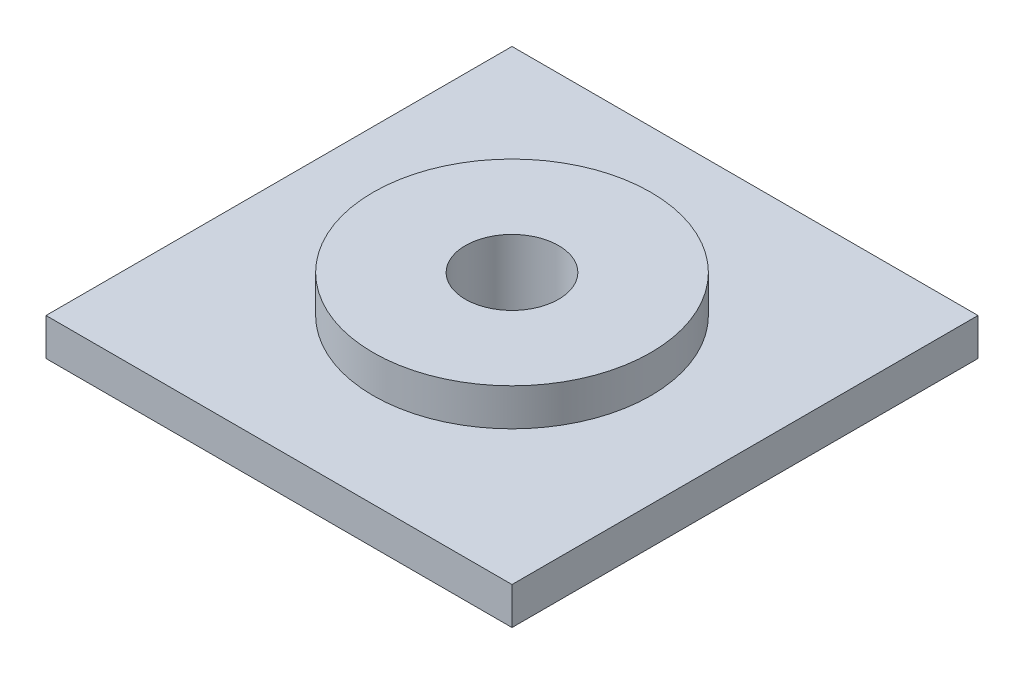
from build123d import *

# Parameters (mm, degrees)
SKETCH1_W           = 25
SKETCH1_H           = 25
BOSS_EXTRUDE1_DEPTH = 2
SKETCH2_R           = 7.45
BOSS_EXTRUDE2_DEPTH = 2
SKETCH3_R           = 2.5
CUT_EXTRUDE1_DEPTH  = 19.12456896
CUT_EXTRUDE2_DEPTH  = 1


with BuildPart() as part:
    # Sketch1 → Boss-Extrude1 (new body)
    with BuildSketch(Plane(origin=(0, 0, 0), x_dir=(1, 0, 0), z_dir=(0, 1, 0))):
        Rectangle(SKETCH1_W, SKETCH1_H)
    extrude(amount=BOSS_EXTRUDE1_DEPTH)

    # Sketch2 → Boss-Extrude2 (add)
    with BuildSketch(Plane(origin=(0, 2, 0), x_dir=(1, 0, 0), z_dir=(0, 1, 0))):
        with Locations(Location((0, 0, 0), (0, 0, 90))):
            Circle(SKETCH2_R)
    extrude(amount=BOSS_EXTRUDE2_DEPTH)

    # Sketch3 → Cut-Extrude1 (cut, through all)
    with BuildSketch(Plane(origin=(0, 4, 0), x_dir=(1, 0, 0), z_dir=(0, 1, 0))):
        with Locations(Location((0, 0, 0), (0, 0, 270))):
            Circle(SKETCH3_R)
    extrude(amount=-CUT_EXTRUDE1_DEPTH, mode=Mode.SUBTRACT)

    # Sketch4 → Cut-Extrude2 (cut)
    with BuildSketch(Plane(origin=(0, 0, 0), x_dir=(1, 0, 0), z_dir=(0, 1, 0))):
        with BuildLine():
            Line((-2.846153846, 9.384615385), (-3.923076923, 9.384615385))
            Line((-3.923076923, 9.384615385), (-3.923076923, 8.860576923))
            add(Edge.make_bspline(
                [(-3.923076923, 8.860576923), (-3.970977914, 8.908922789), (-4.065291029, 9.004111825), (-4.22158631, 9.126485888), (-4.384618114, 9.23113083), (-4.556362128, 9.315847497), (-4.736398274, 9.380534791), (-4.923873273, 9.427936686), (-5.119750076, 9.455902319), (-5.253115705, 9.459638922), (-5.320913462, 9.461538462)],
                knots=[0, 0, 0, 0, 1.041528618, 2.050684245, 3.032913108, 4.004406485, 4.976926473, 5.95771665, 6.961784757, 8, 8, 8, 8], degree=3))
            add(Edge.make_bspline(
                [(-5.320913462, 9.461538462), (-5.388800735, 9.459403104), (-5.522434636, 9.455199723), (-5.717405568, 9.416734845), (-5.902109375, 9.354242416), (-6.074513882, 9.265167137), (-6.235865126, 9.155163796), (-6.379015142, 9.018549277), (-6.507867359, 8.860761905), (-6.576550551, 8.741472956), (-6.611778846, 8.680288462)],
                knots=[0, 0, 0, 0, 1.023965777, 2.015643508, 2.987309376, 3.958410333, 4.93654923, 5.924956801, 6.93568961, 8, 8, 8, 8], degree=3))
            add(Edge.make_bspline(
                [(-6.611778846, 8.680288462), (-6.657157443, 8.741639401), (-6.746222894, 8.862054078), (-6.904099518, 9.019269092), (-7.074811252, 9.155178042), (-7.261660974, 9.265979258), (-7.459686604, 9.353938372), (-7.668021605, 9.416502652), (-7.884777144, 9.455135438), (-8.032291183, 9.459386389), (-8.106971154, 9.461538462)],
                knots=[0, 0, 0, 0, 1.041189987, 2.043563759, 3.033412161, 4.015238574, 5.00275396, 5.986226558, 6.980513695, 8, 8, 8, 8], degree=3))
            add(Edge.make_bspline(
                [(-8.106971154, 9.461538462), (-8.184106696, 9.459303866), (-8.334320993, 9.454952199), (-8.55200308, 9.412139414), (-8.755888697, 9.345987237), (-8.941472027, 9.249719629), (-9.109282373, 9.135686834), (-9.252277032, 9.000952329), (-9.370949533, 8.850217576), (-9.448220549, 8.709468095), (-9.498174185, 8.585029437), (-9.528336634, 8.476744488), (-9.556547856, 8.355830647), (-9.576814796, 8.220662661), (-9.595733091, 8.072511006), (-9.606715904, 7.910390718), (-9.614181037, 7.734847945), (-9.614973928, 7.613390855), (-9.615384615, 7.550480769)],
                knots=[0, 0, 0, 0, 1.321991808, 2.574456155, 3.791773975, 4.987670122, 6.148905103, 7.262530793, 8.344737981, 9.427709016, 10.004683293, 10.642050061, 11.354108788, 12.133887687, 12.985666279, 13.916212488, 14.92067847, 16, 16, 16, 16], degree=3))
            Line((-9.615384615, 7.550480769), (-9.615384615, 5))
            Line((-9.615384615, 5), (-8.538461538, 5))
            Line((-8.538461538, 5), (-8.538461538, 7.201923077))
            add(Edge.make_bspline(
                [(-8.538461538, 7.201923077), (-8.537565204, 7.260820426), (-8.535844771, 7.373868566), (-8.528530547, 7.53601454), (-8.512158186, 7.683066945), (-8.49296768, 7.815840316), (-8.465505696, 7.933630671), (-8.432020794, 8.03672196), (-8.39317851, 8.125262579), (-8.346277623, 8.1992433), (-8.293748575, 8.261546752), (-8.235317587, 8.314953149), (-8.171593891, 8.360519374), (-8.101999738, 8.399358106), (-8.02471194, 8.425625509), (-7.942339611, 8.44623585), (-7.854238162, 8.46027164), (-7.793324841, 8.461108413), (-7.762019231, 8.461538462)],
                knots=[0, 0, 0, 0, 1.669139205, 3.203761885, 4.596586177, 5.860166715, 7.002923539, 8.018877315, 8.928339525, 9.734594377, 10.491888885, 11.231098709, 11.971440889, 12.708030942, 13.480072485, 14.275788656, 15.113863979, 16, 16, 16, 16], degree=3))
            add(Edge.make_bspline(
                [(-7.762019231, 8.461538462), (-7.713777729, 8.459870628), (-7.619113381, 8.456597836), (-7.481168132, 8.425322645), (-7.351360636, 8.374191054), (-7.230177205, 8.304631055), (-7.120225439, 8.217751929), (-7.024045477, 8.114705003), (-6.944614241, 7.994896406), (-6.889630003, 7.883738061), (-6.855271761, 7.783228582), (-6.831035144, 7.697150284), (-6.812143665, 7.599808462), (-6.797357168, 7.492188962), (-6.78317125, 7.373683401), (-6.776211719, 7.244441634), (-6.769089994, 7.104643207), (-6.769182704, 7.00802451), (-6.769230769, 6.957932692)],
                knots=[0, 0, 0, 0, 1.129913425, 2.217230253, 3.297175357, 4.391411011, 5.481605898, 6.571841268, 7.681894157, 8.841607612, 9.468549532, 10.170608623, 10.93710061, 11.791434153, 12.717934886, 13.734733707, 14.825576123, 16, 16, 16, 16], degree=3))
            Line((-6.769230769, 6.957932692), (-6.769230769, 5))
            Line((-6.769230769, 5), (-5.692307692, 5))
            Line((-5.692307692, 5), (-5.692307692, 7.102163462))
            add(Edge.make_bspline(
                [(-5.692307692, 7.102163462), (-5.692217274, 7.149044475), (-5.692043337, 7.239228358), (-5.686815156, 7.369455611), (-5.679892021, 7.489702621), (-5.670186594, 7.600304777), (-5.658993294, 7.701124518), (-5.642838783, 7.791610289), (-5.625866979, 7.872260695), (-5.596768591, 7.96387715), (-5.55576522, 8.065403513), (-5.494505586, 8.173066569), (-5.42043432, 8.263209005), (-5.335423572, 8.336532322), (-5.239357778, 8.392398806), (-5.134670585, 8.433956527), (-5.019363055, 8.456388109), (-4.939993061, 8.459785448), (-4.899038462, 8.461538462)],
                knots=[0, 0, 0, 0, 1.256487322, 2.417074606, 3.49288742, 4.484586665, 5.393016842, 6.210437544, 6.947749329, 7.599905853, 8.784490193, 9.876739139, 10.906602197, 11.896672079, 12.869113195, 13.872201355, 14.902064413, 16, 16, 16, 16], degree=3))
            add(Edge.make_bspline(
                [(-4.899038462, 8.461538462), (-4.852763288, 8.459967802), (-4.761114921, 8.456857098), (-4.627615072, 8.423445589), (-4.499976837, 8.373252167), (-4.381008125, 8.301752034), (-4.272712789, 8.212828378), (-4.177495793, 8.106850368), (-4.098481998, 7.983943712), (-4.043253696, 7.869719222), (-4.009396438, 7.76670217), (-3.984508134, 7.678388768), (-3.966319537, 7.578903259), (-3.951143963, 7.46936269), (-3.937042031, 7.349637759), (-3.930053703, 7.219201963), (-3.922939016, 7.078199879), (-3.923029846, 6.980780691), (-3.923076923, 6.930288462)],
                knots=[0, 0, 0, 0, 1.07893236, 2.136834559, 3.195274846, 4.273923004, 5.364443877, 6.458052972, 7.587287137, 8.767908, 9.410170275, 10.118584836, 10.909717261, 11.770069756, 12.702352573, 13.724628867, 14.820678298, 16, 16, 16, 16], degree=3))
            Line((-3.923076923, 6.930288462), (-3.923076923, 5))
            Line((-3.923076923, 5), (-2.846153846, 5))
            Line((-2.846153846, 5), (-2.846153846, 9.384615385))
        make_face()
        with BuildLine():
            Line((5, 9.384615385), (3.923076923, 9.384615385))
            Line((3.923076923, 9.384615385), (3.923076923, 8.860576923))
            add(Edge.make_bspline(
                [(3.923076923, 8.860576923), (3.875175932, 8.908922789), (3.780862817, 9.004111825), (3.624567536, 9.126485888), (3.461535732, 9.23113083), (3.289791718, 9.315847497), (3.109755573, 9.380534791), (2.922280573, 9.427936686), (2.72640377, 9.455902319), (2.593038141, 9.459638922), (2.525240385, 9.461538462)],
                knots=[0, 0, 0, 0, 1.041528618, 2.050684245, 3.032913108, 4.004406485, 4.976926473, 5.95771665, 6.961784757, 8, 8, 8, 8], degree=3))
            add(Edge.make_bspline(
                [(2.525240385, 9.461538462), (2.457353111, 9.459403104), (2.32371921, 9.455199723), (2.128748278, 9.416734845), (1.944044471, 9.354242416), (1.771639964, 9.265167137), (1.61028872, 9.155163796), (1.467138704, 9.018549277), (1.338286487, 8.860761905), (1.269603295, 8.741472956), (1.234375, 8.680288462)],
                knots=[0, 0, 0, 0, 1.023965777, 2.015643508, 2.987309376, 3.958410333, 4.93654923, 5.924956801, 6.93568961, 8, 8, 8, 8], degree=3))
            add(Edge.make_bspline(
                [(1.234375, 8.680288462), (1.188996403, 8.741639401), (1.099930952, 8.862054078), (0.942054328, 9.019269092), (0.771342594, 9.155178042), (0.584492872, 9.265979258), (0.386467243, 9.353938372), (0.178132241, 9.416502652), (-0.038623298, 9.455135438), (-0.186137337, 9.459386389), (-0.260817308, 9.461538462)],
                knots=[0, 0, 0, 0, 1.041189987, 2.043563759, 3.033412161, 4.015238574, 5.00275396, 5.986226558, 6.980513695, 8, 8, 8, 8], degree=3))
            add(Edge.make_bspline(
                [(-0.260817308, 9.461538462), (-0.33795285, 9.459303866), (-0.488167147, 9.454952199), (-0.705849234, 9.412139414), (-0.90973485, 9.345987237), (-1.095318181, 9.249719629), (-1.263128527, 9.135686834), (-1.406123186, 9.000952329), (-1.524795687, 8.850217576), (-1.602066703, 8.709468095), (-1.652020339, 8.585029437), (-1.682182788, 8.476744488), (-1.71039401, 8.355830647), (-1.73066095, 8.220662661), (-1.749579244, 8.072511006), (-1.760562058, 7.910390718), (-1.768027191, 7.734847945), (-1.768820082, 7.613390855), (-1.769230769, 7.550480769)],
                knots=[0, 0, 0, 0, 1.321991808, 2.574456155, 3.791773975, 4.987670122, 6.148905103, 7.262530793, 8.344737981, 9.427709016, 10.004683293, 10.642050061, 11.354108788, 12.133887687, 12.985666279, 13.916212488, 14.92067847, 16, 16, 16, 16], degree=3))
            Line((-1.769230769, 7.550480769), (-1.769230769, 5))
            Line((-1.769230769, 5), (-0.692307692, 5))
            Line((-0.692307692, 5), (-0.692307692, 7.201923077))
            add(Edge.make_bspline(
                [(-0.692307692, 7.201923077), (-0.691411358, 7.260820426), (-0.689690925, 7.373868566), (-0.682376701, 7.53601454), (-0.66600434, 7.683066945), (-0.646813834, 7.815840316), (-0.61935185, 7.933630671), (-0.585866948, 8.03672196), (-0.547024664, 8.125262579), (-0.500123777, 8.1992433), (-0.447594729, 8.261546752), (-0.389163741, 8.314953149), (-0.325440045, 8.360519374), (-0.255845892, 8.399358106), (-0.178558094, 8.425625509), (-0.096185765, 8.44623585), (-0.008084316, 8.46027164), (0.052829005, 8.461108413), (0.084134615, 8.461538462)],
                knots=[0, 0, 0, 0, 1.669139205, 3.203761885, 4.596586177, 5.860166715, 7.002923539, 8.018877315, 8.928339525, 9.734594377, 10.491888885, 11.231098709, 11.971440889, 12.708030942, 13.480072485, 14.275788656, 15.113863979, 16, 16, 16, 16], degree=3))
            add(Edge.make_bspline(
                [(0.084134615, 8.461538462), (0.132376117, 8.459870628), (0.227040466, 8.456597836), (0.364985715, 8.425322645), (0.49479321, 8.374191054), (0.615976641, 8.304631055), (0.725928407, 8.217751929), (0.82210837, 8.114705003), (0.901539605, 7.994896406), (0.956523843, 7.883738061), (0.990882085, 7.783228582), (1.015118702, 7.697150284), (1.034010181, 7.599808462), (1.048796678, 7.492188962), (1.062982596, 7.373683401), (1.069942128, 7.244441634), (1.077063852, 7.104643207), (1.076971142, 7.00802451), (1.076923077, 6.957932692)],
                knots=[0, 0, 0, 0, 1.129913425, 2.217230253, 3.297175357, 4.391411011, 5.481605898, 6.571841268, 7.681894157, 8.841607612, 9.468549532, 10.170608623, 10.93710061, 11.791434153, 12.717934886, 13.734733707, 14.825576123, 16, 16, 16, 16], degree=3))
            Line((1.076923077, 6.957932692), (1.076923077, 5))
            Line((1.076923077, 5), (2.153846154, 5))
            Line((2.153846154, 5), (2.153846154, 7.102163462))
            add(Edge.make_bspline(
                [(2.153846154, 7.102163462), (2.153936573, 7.149044475), (2.154110509, 7.239228358), (2.159338691, 7.369455611), (2.166261825, 7.489702621), (2.175967252, 7.600304777), (2.187160552, 7.701124518), (2.203315063, 7.791610289), (2.220286868, 7.872260695), (2.249385256, 7.96387715), (2.290388626, 8.065403513), (2.35164826, 8.173066569), (2.425719526, 8.263209005), (2.510730274, 8.336532322), (2.606796068, 8.392398806), (2.711483261, 8.433956527), (2.826790791, 8.456388109), (2.906160785, 8.459785448), (2.947115385, 8.461538462)],
                knots=[0, 0, 0, 0, 1.256487322, 2.417074606, 3.49288742, 4.484586665, 5.393016842, 6.210437544, 6.947749329, 7.599905853, 8.784490193, 9.876739139, 10.906602197, 11.896672079, 12.869113195, 13.872201355, 14.902064413, 16, 16, 16, 16], degree=3))
            add(Edge.make_bspline(
                [(2.947115385, 8.461538462), (2.993390558, 8.459967802), (3.085038926, 8.456857098), (3.218538774, 8.423445589), (3.346177009, 8.373252167), (3.465145721, 8.301752034), (3.573441057, 8.212828378), (3.668658054, 8.106850368), (3.747671848, 7.983943712), (3.80290015, 7.869719222), (3.836757408, 7.76670217), (3.861645713, 7.678388768), (3.879834309, 7.578903259), (3.895009883, 7.46936269), (3.909111815, 7.349637759), (3.916100143, 7.219201963), (3.92321483, 7.078199879), (3.923124, 6.980780691), (3.923076923, 6.930288462)],
                knots=[0, 0, 0, 0, 1.07893236, 2.136834559, 3.195274846, 4.273923004, 5.364443877, 6.458052972, 7.587287137, 8.767908, 9.410170275, 10.118584836, 10.909717261, 11.770069756, 12.702352573, 13.724628867, 14.820678298, 16, 16, 16, 16], degree=3))
            Line((3.923076923, 6.930288462), (3.923076923, 5))
            Line((3.923076923, 5), (5, 5))
            Line((5, 5), (5, 9.384615385))
        make_face()
        with BuildLine():
            Line((8.808894231, 11), (6.076923077, 11))
            Line((6.076923077, 11), (6.076923077, 10))
            Line((6.076923077, 10), (7.955528846, 10))
            Line((7.955528846, 10), (8.189903846, 8.865384615))
            add(Edge.make_bspline(
                [(8.189903846, 8.865384615), (8.157966897, 8.874279459), (8.094980673, 8.891821918), (8.000091847, 8.909414784), (7.908131351, 8.920817921), (7.847787435, 8.922338947), (7.818509615, 8.923076923)],
                knots=[0, 0, 0, 0, 1.05461699, 2.079921384, 3.068411212, 4, 4, 4, 4], degree=3))
            add(Edge.make_bspline(
                [(7.818509615, 8.923076923), (7.754710179, 8.921614996), (7.628947436, 8.918733216), (7.444972501, 8.89137572), (7.268805633, 8.848288493), (7.100985921, 8.786837219), (6.941677303, 8.706856797), (6.790686666, 8.610102908), (6.647828694, 8.496405615), (6.515641145, 8.365693734), (6.394181704, 8.22216913), (6.288579647, 8.066932084), (6.198388901, 7.902196125), (6.126654299, 7.726937259), (6.070035236, 7.542256229), (6.029121037, 7.348034685), (6.004926427, 7.144042446), (6.001663932, 7.004873127), (6, 6.933894231)],
                knots=[0, 0, 0, 0, 1.01440847, 1.999622559, 2.951875003, 3.895578053, 4.836219714, 5.782137149, 6.743708247, 7.735272588, 8.734977101, 9.730283169, 10.717124674, 11.717316708, 12.737475749, 13.78628267, 14.87096371, 16, 16, 16, 16], degree=3))
            add(Edge.make_bspline(
                [(6, 6.933894231), (6.002033352, 6.86210956), (6.006045749, 6.720457421), (6.032222963, 6.51217867), (6.078426217, 6.312694647), (6.141891009, 6.121471336), (6.22550181, 5.939914184), (6.326055242, 5.766142395), (6.445251391, 5.60144582), (6.581920535, 5.447512799), (6.730497822, 5.306815063), (6.88869756, 5.183042995), (7.055408348, 5.078889803), (7.230634209, 4.994716415), (7.413369816, 4.928119929), (7.603670631, 4.879640866), (7.802461492, 4.851840817), (7.937414658, 4.848070334), (8.006009615, 4.846153846)],
                knots=[0, 0, 0, 0, 1.06808661, 2.107647099, 3.116961351, 4.110378221, 5.100014249, 6.085620622, 7.093190682, 8.119403071, 9.144090782, 10.133780668, 11.103064255, 12.062861538, 13.020824475, 13.992378307, 14.979551724, 16, 16, 16, 16], degree=3))
            add(Edge.make_bspline(
                [(8.006009615, 4.846153846), (8.067352044, 4.847721653), (8.188332151, 4.850813695), (8.366530538, 4.869819016), (8.538333571, 4.903420602), (8.702829164, 4.952050798), (8.861748086, 5.011903467), (9.01325319, 5.086760541), (9.15817702, 5.175196641), (9.296108049, 5.275597804), (9.424805093, 5.38869582), (9.542266117, 5.512501085), (9.649202247, 5.645453095), (9.743325215, 5.789192071), (9.824339976, 5.943505649), (9.896185518, 6.106575208), (9.954991814, 6.280103713), (9.984834316, 6.400403313), (10, 6.461538462)],
                knots=[0, 0, 0, 0, 1.054957082, 2.080596141, 3.077793124, 4.061112343, 5.027190972, 5.994718051, 6.962465889, 7.943658696, 8.924948258, 9.904494768, 10.875059, 11.855380583, 12.854004648, 13.869083016, 14.917087635, 16, 16, 16, 16], degree=3))
            Line((10, 6.461538462), (8.769230769, 6.461538462))
            add(Edge.make_bspline(
                [(8.769230769, 6.461538462), (8.746732278, 6.419174293), (8.703009028, 6.336844367), (8.61983774, 6.22753902), (8.526732763, 6.134328116), (8.424533955, 6.056300964), (8.312579131, 5.997844349), (8.195430239, 5.953513557), (8.071615587, 5.927896434), (7.987292342, 5.92469404), (7.944711538, 5.923076923)],
                knots=[0, 0, 0, 0, 1.104910296, 2.147267069, 3.153527244, 4.136738762, 5.099945312, 6.05603338, 7.018353, 8, 8, 8, 8], degree=3))
            add(Edge.make_bspline(
                [(7.944711538, 5.923076923), (7.91503329, 5.924193556), (7.856640835, 5.926390551), (7.770608788, 5.938013203), (7.688487418, 5.960026243), (7.609666174, 5.990509187), (7.533933323, 6.02852486), (7.462374519, 6.076517171), (7.39374477, 6.1317581), (7.329088898, 6.195147253), (7.270529315, 6.265811414), (7.219178966, 6.341744873), (7.173264672, 6.42126037), (7.139255253, 6.507507716), (7.111404414, 6.597911533), (7.09089393, 6.693153765), (7.078636603, 6.793345648), (7.077501902, 6.861743837), (7.076923077, 6.896634615)],
                knots=[0, 0, 0, 0, 0.978869489, 1.925942215, 2.855067702, 3.774946051, 4.70828698, 5.642468714, 6.60995405, 7.609372294, 8.622401667, 9.629904756, 10.629323, 11.642352373, 12.678539694, 13.745912462, 14.850161547, 16, 16, 16, 16], degree=3))
            add(Edge.make_bspline(
                [(7.076923077, 6.896634615), (7.07759487, 6.9307155), (7.078902533, 6.997054768), (7.089719776, 7.094464576), (7.109071617, 7.186888856), (7.135438666, 7.275035507), (7.169191636, 7.358369261), (7.210440022, 7.437386161), (7.259360041, 7.511686804), (7.316214334, 7.579758503), (7.376843167, 7.642195802), (7.441978015, 7.696802965), (7.511032049, 7.74212312), (7.581859498, 7.781688933), (7.657287541, 7.810484069), (7.735620102, 7.830314218), (7.816774806, 7.844864783), (7.872128668, 7.845719682), (7.900240385, 7.846153846)],
                knots=[0, 0, 0, 0, 1.166249705, 2.270133367, 3.348514167, 4.393962215, 5.415026464, 6.420877785, 7.440098956, 8.453121383, 9.451844239, 10.415694839, 11.355045125, 12.27538808, 13.187007209, 14.108269027, 15.039275622, 16, 16, 16, 16], degree=3))
            add(Edge.make_bspline(
                [(7.900240385, 7.846153846), (7.930776242, 7.84499518), (7.991976652, 7.842672964), (8.082905144, 7.823777717), (8.17273729, 7.793198118), (8.261972651, 7.751008715), (8.349725411, 7.695796098), (8.438311408, 7.631038029), (8.524765478, 7.55202922), (8.579735381, 7.493183279), (8.608173077, 7.462740385)],
                knots=[0, 0, 0, 0, 0.88288272, 1.769486374, 2.674910571, 3.623812639, 4.617874466, 5.670434592, 6.794841017, 8, 8, 8, 8], degree=3))
            Line((8.608173077, 7.462740385), (9.514423077, 7.670673077))
            Line((9.514423077, 7.670673077), (8.808894231, 11))
        make_face()
    extrude(amount=CUT_EXTRUDE2_DEPTH, mode=Mode.SUBTRACT)


solid = part.part
